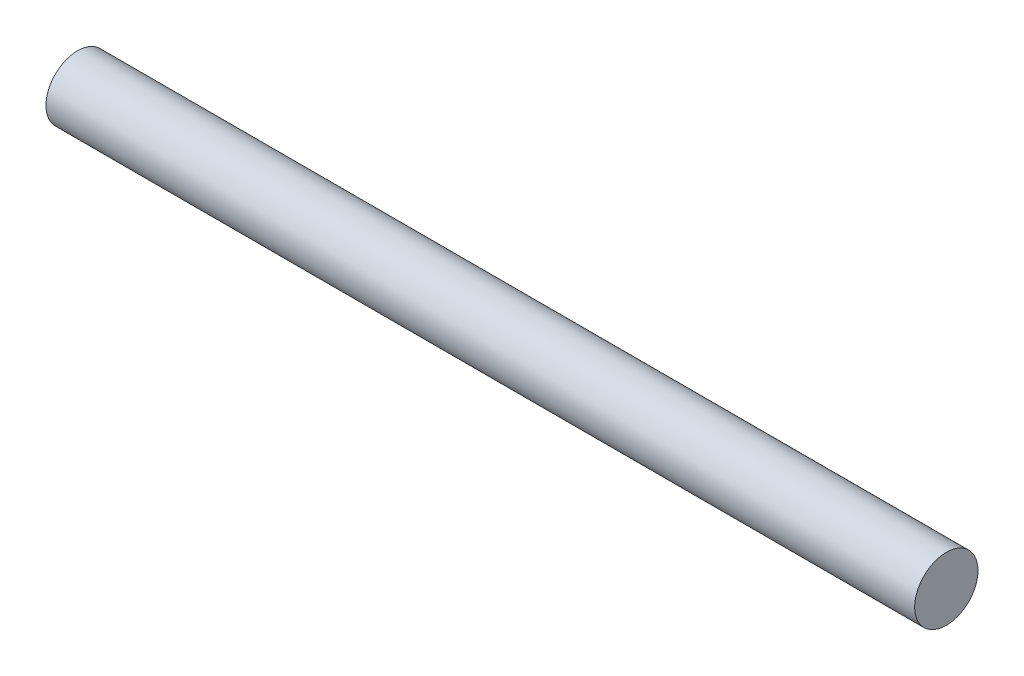
from build123d import *

# Parameters (mm, degrees)
SKETCH1_R           = 0.875
BOSS_EXTRUDE1_DEPTH = 24


with BuildPart() as part:
    # Sketch1 → Boss-Extrude1 (new body)
    with BuildSketch(Plane.YZ):
        with Locations(Location((0, 0, 0), (0, 0, 270))):
            Circle(SKETCH1_R)
    extrude(amount=BOSS_EXTRUDE1_DEPTH)


solid = part.part
